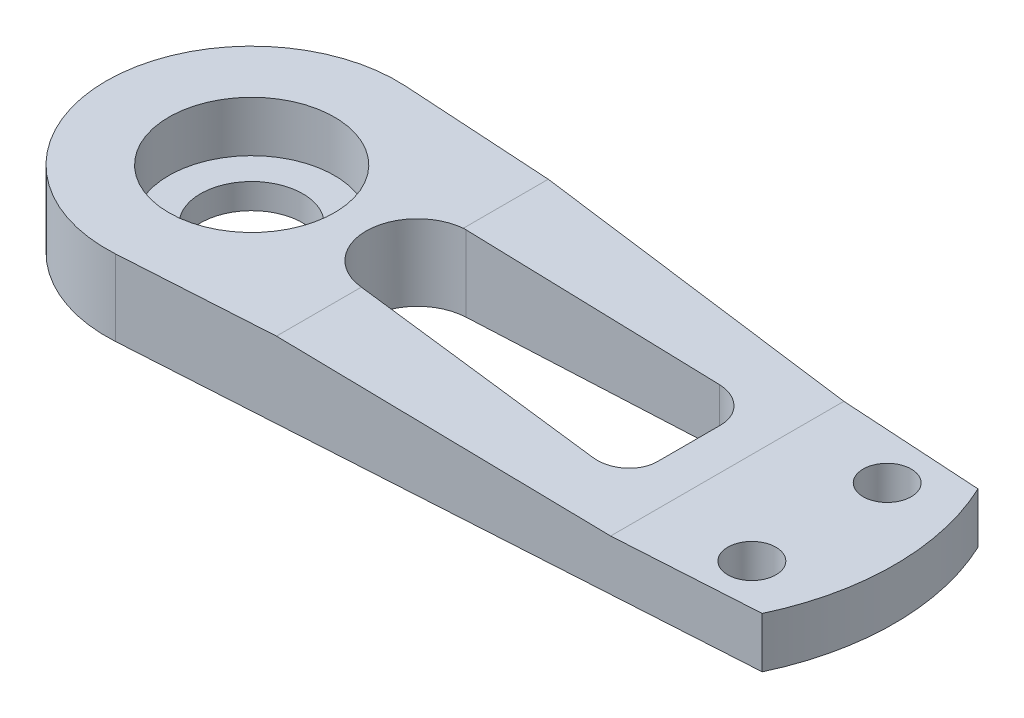
from build123d import *

# Parameters (mm, degrees)
SKETCH1_R               = 1.9
SKETCH1_R_2             = 4.05
BOSS_EXTRUDE2_DEPTH     = 6
SKETCH2_R               = 6.55
CUT_EXTRUDE3_DEPTH      = 4
CUT_EXTRUDE2_DEPTH      = 21
CUT_EXTRUDE2_DEPTH_BACK = 16


with BuildPart() as part:
    # Sketch1 → Boss-Extrude2 (new body)
    with BuildSketch(Plane(origin=(0, 0, 0), x_dir=(1, 0, 0), z_dir=(0, 1, 0))):
        with BuildLine():
            Line((0.702058205, 11.478550182), (48.9, 8.530637776))
            ThreePointArc((48.9, 8.530637776), (50.810549507, 0), (48.9, -8.530637776))
            Line((48.9, -8.530637776), (0.702058205, -11.478550182))
            ThreePointArc((0.702058205, -11.478550182), (-11.5, 0), (0.702058205, 11.478550182))
        make_face()
        with Locations(Location((44.9, -5.35, 0), (0, 0, 270))):
            Circle(SKETCH1_R, mode=Mode.SUBTRACT)
        with Locations(Location((0, 0, 0), (0, 0, 270))):
            Circle(SKETCH1_R_2, mode=Mode.SUBTRACT)
        with Locations(Location((44.9, 5.35, 0), (0, 0, 270))):
            Circle(SKETCH1_R, mode=Mode.SUBTRACT)
        with BuildLine():
            Line((12.898162181, 4.044967428), (31.975408753, 4.996893474))
            ThreePointArc((31.975408753, 4.996893474), (33.823154358, 4.311281054), (34.6, 2.5))
            Line((34.6, 2.5), (34.6, -2.5))
            ThreePointArc((34.6, -2.5), (33.823154358, -4.311281054), (31.975408753, -4.996893474))
            Line((31.975408753, -4.996893474), (12.898162181, -4.044967428))
            ThreePointArc((12.898162181, -4.044967428), (9.05, 0), (12.898162181, 4.044967428))
        make_face(mode=Mode.SUBTRACT)
    extrude(amount=BOSS_EXTRUDE2_DEPTH)

    # Sketch2 → Cut-Extrude3 (cut)
    with BuildSketch(Plane(origin=(0, 6, 0), x_dir=(1, 0, 0), z_dir=(0, 1, 0))):
        with Locations(Location((0, 0, 0), (0, 0, 270))):
            Circle(SKETCH2_R)
    extrude(amount=-CUT_EXTRUDE3_DEPTH, mode=Mode.SUBTRACT)

    # Sketch3 → Cut-Extrude2 (cut, two sides: drawn at the far end of the back side and taken through both)
    with BuildSketch(Plane.XY.offset(-CUT_EXTRUDE2_DEPTH_BACK)):
        Polygon((50.810549507, 4), (37.603420494, 4), (12.707964704, 6), (50.810549507, 6), align=None)
    extrude(amount=CUT_EXTRUDE2_DEPTH + CUT_EXTRUDE2_DEPTH_BACK, mode=Mode.SUBTRACT)


solid = part.part
